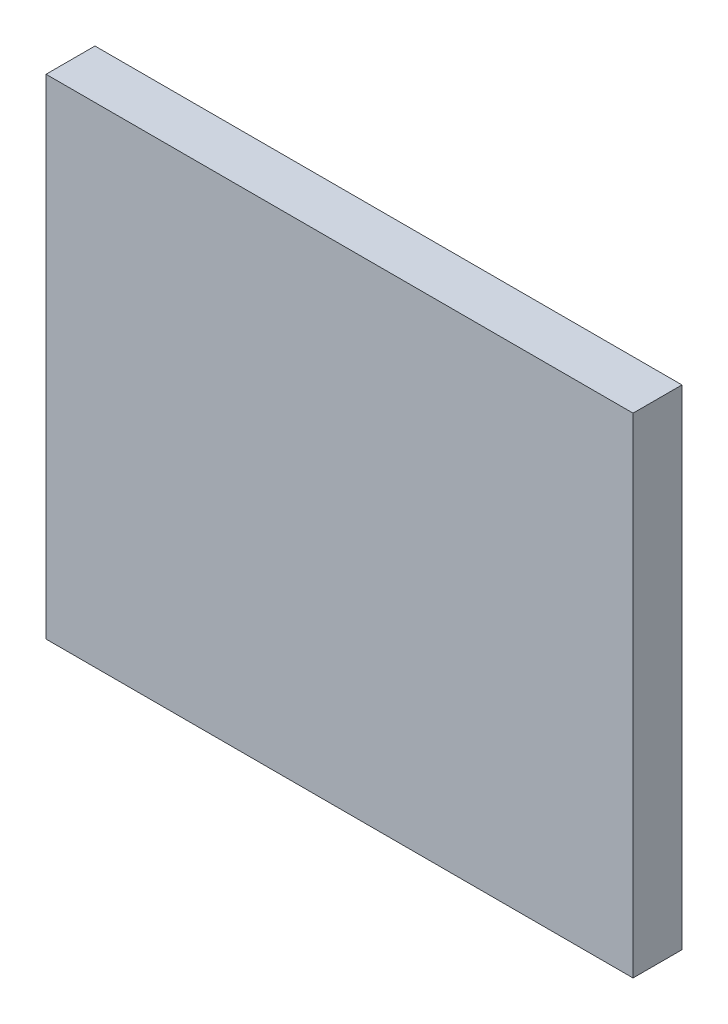
from build123d import *

# Parameters (mm, degrees)
SKETCH1_W           = 60
SKETCH1_H           = 50
BOSS_EXTRUDE1_DEPTH = 5


with BuildPart() as part:
    # Sketch1 → Boss-Extrude1 (new body)
    with BuildSketch(Plane.XY):
        Rectangle(SKETCH1_W, SKETCH1_H)
    extrude(amount=BOSS_EXTRUDE1_DEPTH)


solid = part.part
